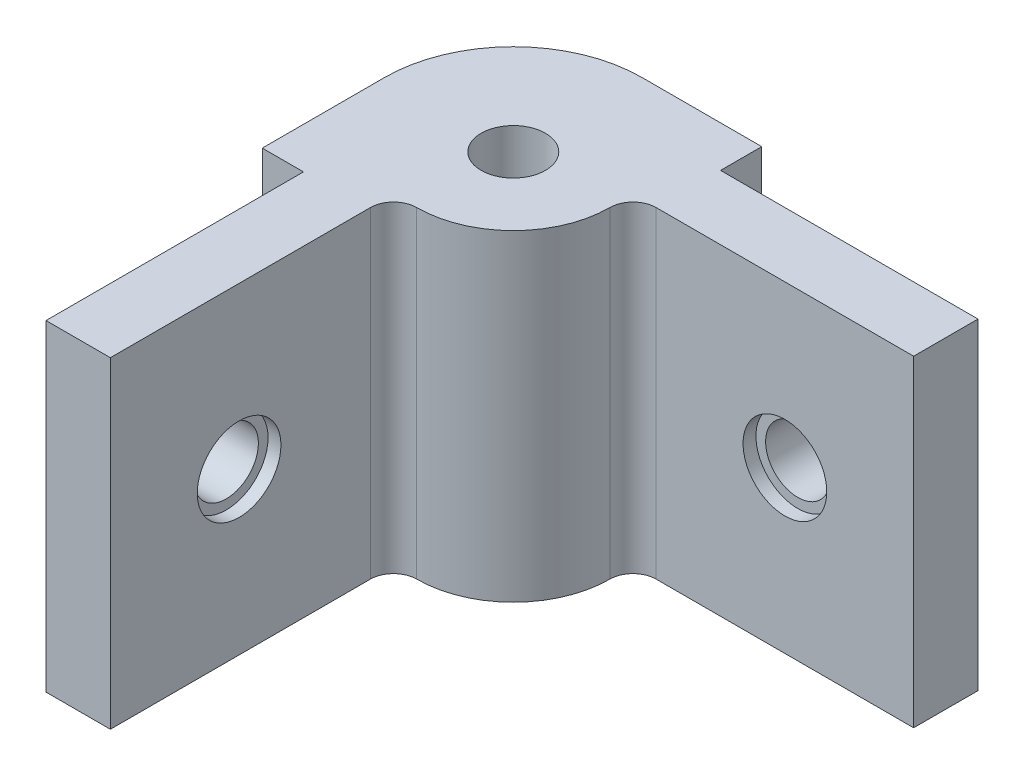
from build123d import *

# Parameters (mm, degrees)
SKETCH4_R           = 2.5
BOSS_EXTRUDE1_DEPTH = 25
SKETCH5_R           = 2.5
CUT_EXTRUDE1_DEPTH  = 55.976783394
SKETCH6_R           = 3.25
CUT_EXTRUDE2_DEPTH  = 1
SKETCH7_R           = 2.5
CUT_EXTRUDE3_DEPTH  = 46.809522816
SKETCH8_R           = 3.25
CUT_EXTRUDE4_DEPTH  = 1


with BuildPart() as part:
    # Sketch4 → Boss-Extrude1 (new body)
    with BuildSketch(Plane(origin=(0, 0, 0), x_dir=(1, 0, 0), z_dir=(0, 1, 0))):
        with BuildLine():
            Line((12.859651739, 14.301163983), (32.859651739, 14.301163983))
            Line((32.859651739, 14.301163983), (32.859651739, 19.301163983))
            Line((32.859651739, 19.301163983), (12.859651739, 19.301163983))
            Line((12.859651739, 19.301163983), (12.859651739, 22.501163983))
            Line((12.859651739, 22.501163983), (3.559651739, 22.501163983))
            ThreePointArc((3.559651739, 22.501163983), (-3.511416073, 19.572231795), (-6.440348261, 12.501163983))
            Line((-6.440348261, 12.501163983), (-6.440348261, 3.001163983))
            Line((-6.440348261, 3.001163983), (-3.240348261, 3.001163983))
            Line((-3.240348261, 3.001163983), (-3.240348261, -16.998836017))
            Line((-3.240348261, -16.998836017), (1.759651739, -16.998836017))
            Line((1.759651739, -16.998836017), (1.759651739, 3.201163983))
            ThreePointArc((1.759651739, 3.201163983), (2.286859533, 4.473956189), (3.559651739, 5.001163983))
            ThreePointArc((3.559651739, 5.001163983), (8.862952598, 7.197863124), (11.059651739, 12.501163983))
            ThreePointArc((11.059651739, 12.501163983), (11.586859533, 13.773956189), (12.859651739, 14.301163983))
        make_face()
        with Locations(Location((3.559651739, 12.501163983, 0), (0, 0, 270))):
            Circle(SKETCH4_R, mode=Mode.SUBTRACT)
    extrude(amount=BOSS_EXTRUDE1_DEPTH)

    # Sketch5 → Cut-Extrude1 (cut, through all)
    with BuildSketch(Plane(origin=(0, 0, -19.301163983), x_dir=(-1, 0, 0), z_dir=(0, 0, -1))):
        with Locations((-22.859651739, 12.5)):
            Circle(SKETCH5_R)
    extrude(amount=-CUT_EXTRUDE1_DEPTH, mode=Mode.SUBTRACT)

    # Sketch6 → Cut-Extrude2 (cut)
    with BuildSketch(Plane.XY.offset(-14.301163983)):
        with Locations((22.859651739, 12.5)):
            Circle(SKETCH6_R)
    extrude(amount=-CUT_EXTRUDE2_DEPTH, mode=Mode.SUBTRACT)

    # Sketch7 → Cut-Extrude3 (cut, through all)
    with BuildSketch(Plane(origin=(1.759651739, 0, 0), x_dir=(0, 0, -1), z_dir=(1, 0, 0))):
        with Locations((-6.998836017, 12.5)):
            Circle(SKETCH7_R)
    extrude(amount=-CUT_EXTRUDE3_DEPTH, mode=Mode.SUBTRACT)

    # Sketch8 → Cut-Extrude4 (cut)
    with BuildSketch(Plane(origin=(1.759651739, 0, 0), x_dir=(0, 0, -1), z_dir=(1, 0, 0))):
        with Locations((-6.998836017, 12.5)):
            Circle(SKETCH8_R)
    extrude(amount=-CUT_EXTRUDE4_DEPTH, mode=Mode.SUBTRACT)


solid = part.part
